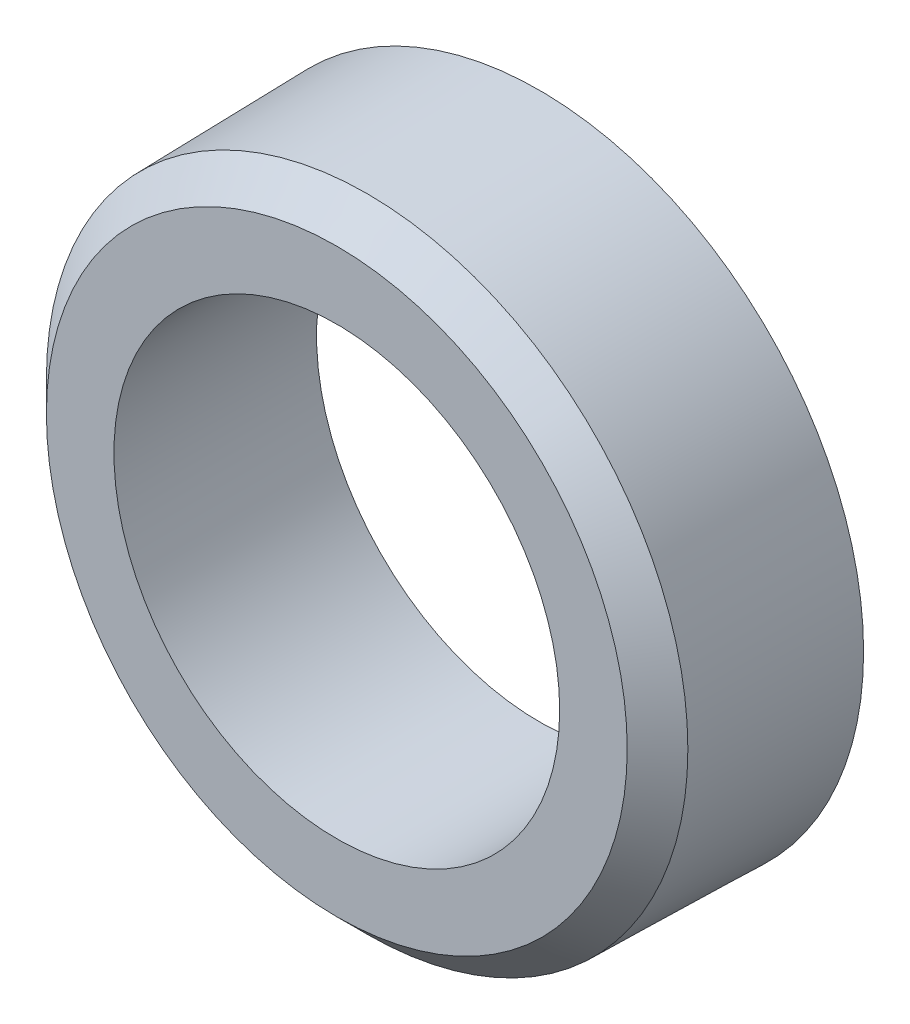
from build123d import *

# Parameters (mm, degrees)
SKETCH_1_R      = 9.6
SKETCH_1_R_2    = 6.6
EXTRUDE_1_DEPTH = 6
CHAMFER_1_SIZE  = 1


with BuildPart() as part:
    # Эскиз1 → Вытянуть1 (new body)
    with BuildSketch(Plane.XY):
        Circle(SKETCH_1_R)
        Circle(SKETCH_1_R_2, mode=Mode.SUBTRACT)
    extrude(amount=EXTRUDE_1_DEPTH)

    # Фаска1
    chamfer_1_edges = [part.edges().sort_by_distance(p)[0] for p in [
        (-9.6, 0, 6),
    ]]
    chamfer(chamfer_1_edges, length=CHAMFER_1_SIZE)

    # Эскиз4 → Вырез-Повернуть1 (revolve, cut)
    with BuildSketch(Plane(origin=(0, 0, 0), x_dir=(0, 0, -1), z_dir=(1, 0, 0)), mode=Mode.PRIVATE) as cut_revolve_1_sk:
        Polygon((0, 9.6), (-6, 9.48), (-6, 9.6), align=None)
    revolve(cut_revolve_1_sk.sketch.rotate(Axis((0, 0, 6), (0, 0, -1)), 90), axis=Axis((0, 0, 6), (0, 0, -1)), mode=Mode.SUBTRACT)


solid = part.part
